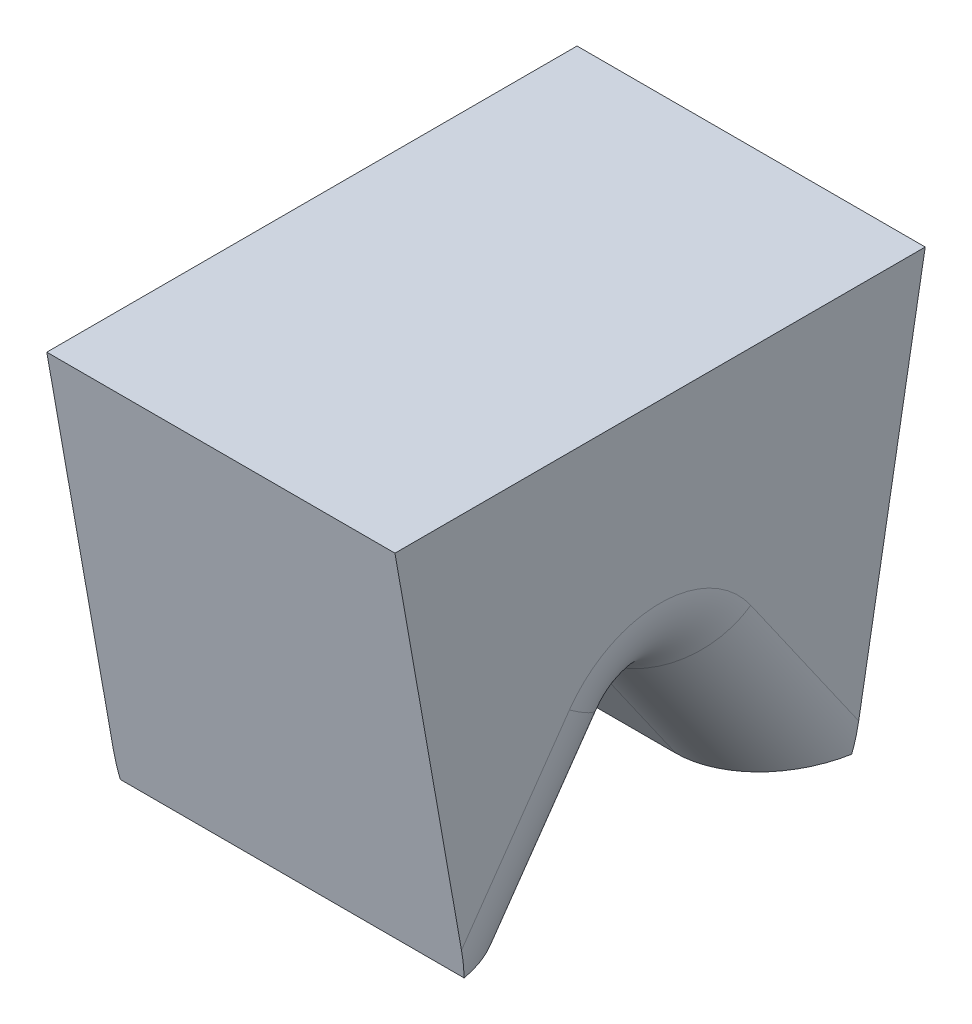
from build123d import *

# Parameters (mm, degrees)
SKETCH_TL_CUTTING_R    = 1.4986
TL_CUTTING_DEPTH       = 29.999999944
SKETCH_TDF_CUTTING_W   = 3.01719996
SKETCH_TDF_CUTTING_H   = 3.01719996
TDF_CUTTING_DEPTH      = 31.074766841
VW_VR_GRINDING_DEPTH   = 1.50859998
VW_VR_GRINDING_2_DEPTH = 1.50859998
ISA_GRINDING_DEPTH     = 1.50859998
SKETCH_PRE_FRX_BRX_W   = 1.13046002
SKETCH_PRE_FRX_BRX_H   = 1.03124
SKETCH_PRE_FRX_BRX_W_2 = 1.15791996
PRE_FRX_BRX_DEPTH      = 1.50859998
FA_BA_GRINDING_DEPTH   = 1.50859998
BR_EDM_R               = 0.18796
FR_EDM_R               = 0.18796


with BuildPart() as part:
    # sketch_TL_cutting → TL_cutting (new body)
    with BuildSketch(Plane(origin=(0, 0, 0), x_dir=(1, 0, 0), z_dir=(0, 1, 0))):
        with Locations(Location((0, 0, 0), (0, 0, 270))):
            Circle(SKETCH_TL_CUTTING_R)
    extrude(amount=TL_CUTTING_DEPTH)

    # sketch_TDF_cutting → TDF_cutting (cut, through all)
    with BuildSketch(Plane(origin=(0, 0, 0), x_dir=(1, 0, 0), z_dir=(0, 1, 0))):
        with Locations((-2.71001998, 0)):
            Rectangle(SKETCH_TDF_CUTTING_W, SKETCH_TDF_CUTTING_H)
    extrude(amount=TDF_CUTTING_DEPTH, mode=Mode.SUBTRACT)


with BuildPart() as body_2:
    # sketch_VW_VR_grinding → VW_VR_grinding (new, symmetric)
    with BuildSketch(Plane(origin=(0, 0, 0), x_dir=(0, 0, -1), z_dir=(1, 0, 0))):
        with BuildLine():
            Line((-1.49360001, -0.00999998), (-1.49360001, 1.020128914))
            ThreePointArc((-1.49360001, 1.020128914), (-1.493648337, 1.021235792), (-1.493792952, 1.022334246))
            Line((-1.493792952, 1.022334246), (-1.51859996, 1.163021782))
            Line((-1.51859996, 1.163021782), (-1.50859998, -0.00999998))
            Line((-1.50859998, -0.00999998), (-1.49360001, -0.00999998))
        make_face()
    extrude(amount=VW_VR_GRINDING_DEPTH, both=True)


with BuildPart() as body_3:
    # sketch_VW_VR_grinding → VW_VR_grinding 2 (new, symmetric)
    with BuildSketch(Plane(origin=(0, 0, 0), x_dir=(0, 0, -1), z_dir=(1, 0, 0))):
        with BuildLine():
            Line((1.49360001, -0.00999998), (1.49360001, 1.020128914))
            ThreePointArc((1.49360001, 1.020128914), (1.493648337, 1.021235792), (1.493792952, 1.022334246))
            Line((1.493792952, 1.022334246), (1.51859996, 1.163021782))
            Line((1.51859996, 1.163021782), (1.50859998, -0.00999998))
            Line((1.50859998, -0.00999998), (1.49360001, -0.00999998))
        make_face()
    extrude(amount=VW_VR_GRINDING_2_DEPTH, both=True)


    add(body_2.part)  # ISA_grinding merges body 2
    # sketch_ISA_grinding → ISA_grinding (add, symmetric)
    with BuildSketch(Plane(origin=(0, 0, 0), x_dir=(0, 0, -1), z_dir=(1, 0, 0))):
        Polygon((-0.40005, 0), (0.40005, 0), (1.50859998, 6.286899348), (1.50859998, -0.02999994), (-1.50859998, -0.02999994), (-1.50859998, 6.286899348), align=None)
    extrude(amount=ISA_GRINDING_DEPTH, both=True)

    # sketch_pre_FRX_BRX → pre_FRX_BRX (add, symmetric)
    with BuildSketch(Plane.XY):
        with Locations((0.93336999, 0.50562002)):
            Rectangle(SKETCH_PRE_FRX_BRX_W, SKETCH_PRE_FRX_BRX_H)
        with Locations((-0.93963998, 0.50562002)):
            Rectangle(SKETCH_PRE_FRX_BRX_W_2, SKETCH_PRE_FRX_BRX_H)
    extrude(amount=PRE_FRX_BRX_DEPTH, both=True)

    # sketch_FA_BA_grinding → FA_BA_grinding (add, symmetric)
    with BuildSketch(Plane.XY):
        Polygon((0.35814, -0.00999998), (0.35814, 1.03124), (1.6256, 10.049686508), (1.6256, -0.00999998), align=None)
        Polygon((-0.36068, -0.00999998), (-0.36068, 1.03124), (-1.32842, 7.917067895), (-1.32842, -0.00999998), align=None)
    extrude(amount=FA_BA_GRINDING_DEPTH, both=True)


with BuildPart() as part_1:
    add(part.part)

    # B1_fix: cut body 3
    add(body_3.part, mode=Mode.SUBTRACT)

    # V-Groove_EDM: sweep along a path in sketch_contour_V-Groove
    with BuildLine(Plane.XY) as v_groove_edm_path:
        Line((-1.20142, 0.28448), (1.4986, 0.28448))
    # sketch_section_V-Groove → V-Groove_EDM (sweep, cut)
    with BuildSketch(Plane(origin=(-1.20142, 0, -1.2954), x_dir=(0, 0, -1), z_dir=(1, 0, 0))):
        with BuildLine():
            Line((-1.262109661, 0.267150146), (-1.068047053, -0.00999998))
            Line((-1.068047053, -0.00999998), (-1.522752947, -0.00999998))
            Line((-1.522752947, -0.00999998), (-1.328690339, 0.267150146))
            ThreePointArc((-1.328690339, 0.267150146), (-1.2954, 0.28448), (-1.262109661, 0.267150146))
        make_face()
    sweep(path=v_groove_edm_path.line, mode=Mode.SUBTRACT)

    # BR_EDM
    br_edm_edges = [part_1.edges().sort_by_distance(p)[0] for p in [
        (-0.36068, 0.28448, 0),
        (-0.36068, 0.133575073, -0.126820612),
        (-0.36068, 0.133575073, 0.126820612),
    ]]
    fillet(br_edm_edges, radius=BR_EDM_R)

    # FR_EDM
    fr_edm_edges = [part_1.edges().sort_by_distance(p)[0] for p in [
        (0.35814, 0.133575073, -0.126820612),
        (0.35814, 0.133575073, 0.126820612),
        (0.35814, 0.28448, 0),
    ]]
    fillet(fr_edm_edges, radius=FR_EDM_R)

    # SurfaceCut1
    split(bisect_by=Plane(origin=(0, 0.835526316, 0), x_dir=(1, 0, 0), z_dir=(0, 1, 0)), keep=Keep.BOTTOM)


solid = part_1.part
